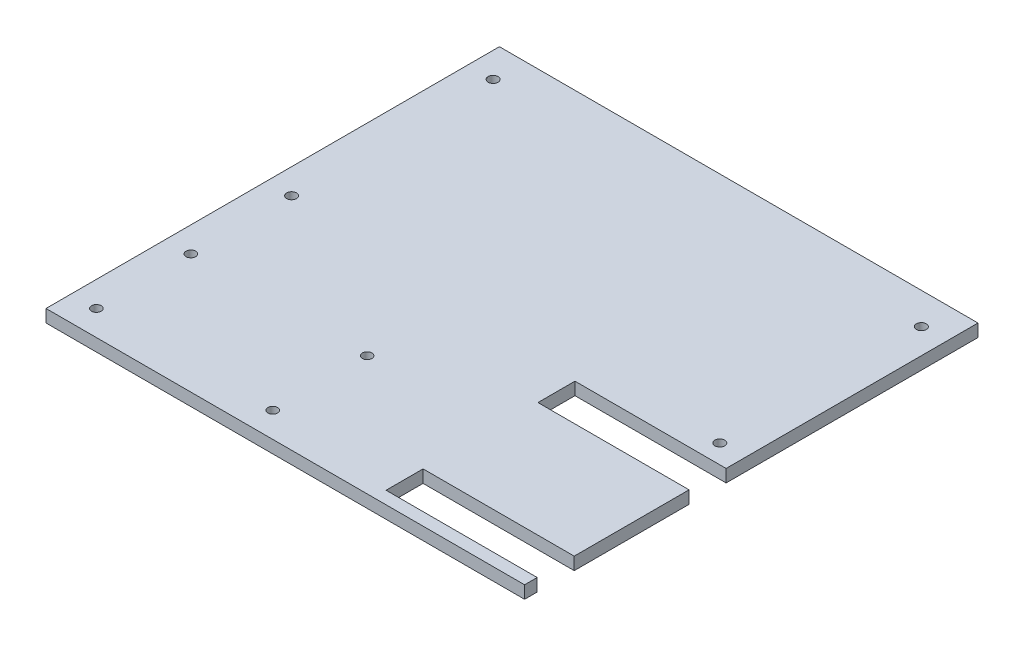
from build123d import *

# Parameters (mm, degrees)
SKETCH1_R           = 2.4257
SKETCH1_R_2         = 2.5019
BOSS_EXTRUDE1_DEPTH = 6.35


with BuildPart() as part:
    # Sketch1 → Boss-Extrude1 (new body)
    with BuildSketch(Plane(origin=(0, 0, 0), x_dir=(1, 0, 0), z_dir=(0, 1, 0))):
        Polygon((120.65, 114.3), (-120.65, 114.3), (-120.65, -114.3), (120.65, -114.3), (120.65, -107.95), (44.45, -107.95), (44.45, -89.281), (120.65, -89.281), (120.65, -31.369), (44.45, -31.369), (44.45, -12.7), (120.65, -12.7), align=None)
        with Locations(Location((-107.95, -101.6, 0), (0, 0, 270))):
            Circle(SKETCH1_R, mode=Mode.SUBTRACT)
        with Locations(Location((-19.05, -101.6, 0), (0, 0, 270))):
            Circle(SKETCH1_R, mode=Mode.SUBTRACT)
        with Locations(Location((-107.95, -53.975, 0), (0, 0, 270))):
            Circle(SKETCH1_R, mode=Mode.SUBTRACT)
        with Locations(Location((-107.95, -3.175, 0), (0, 0, 270))):
            Circle(SKETCH1_R_2, mode=Mode.SUBTRACT)
        with Locations(Location((-19.05, -53.975, 0), (0, 0, 270))):
            Circle(SKETCH1_R, mode=Mode.SUBTRACT)
        with Locations(Location((107.95, -3.175, 0), (0, 0, 270))):
            Circle(SKETCH1_R_2, mode=Mode.SUBTRACT)
        with Locations(Location((-107.95, 98.425, 0), (0, 0, 270))):
            Circle(SKETCH1_R_2, mode=Mode.SUBTRACT)
        with Locations(Location((107.95, 98.425, 0), (0, 0, 270))):
            Circle(SKETCH1_R_2, mode=Mode.SUBTRACT)
    extrude(amount=BOSS_EXTRUDE1_DEPTH)


solid = part.part
